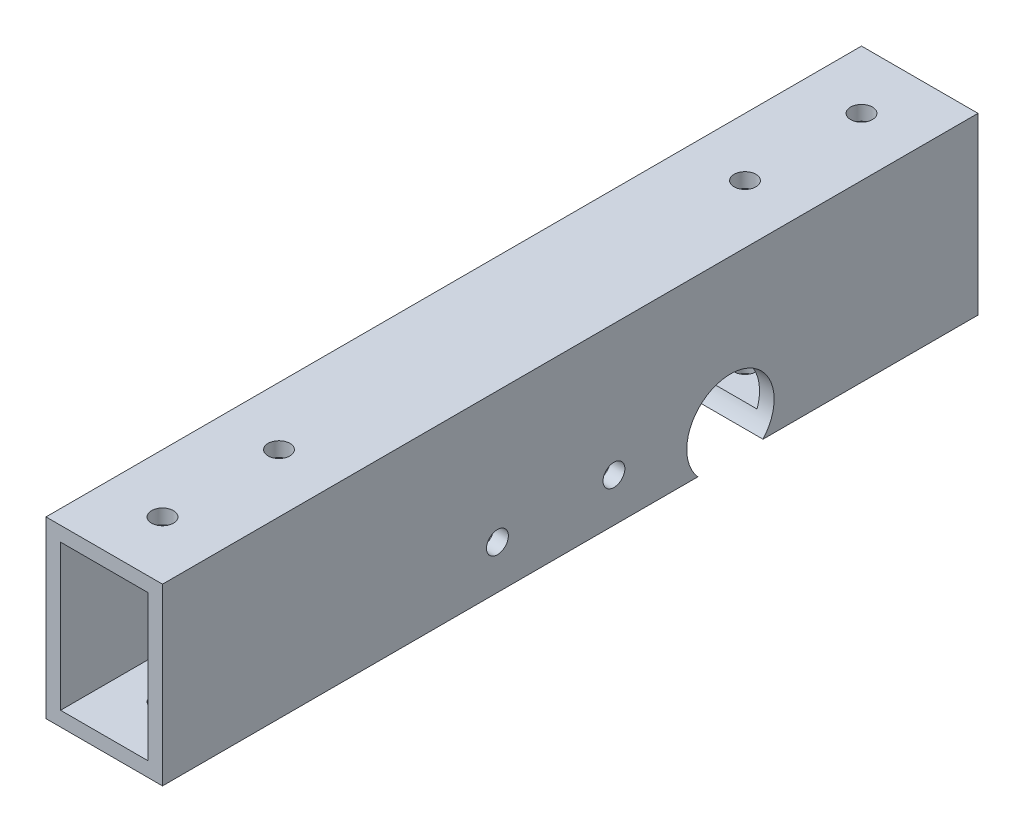
from build123d import *

# Parameters (mm, degrees)
SKETCH1_W           = 25.4
SKETCH1_H           = 38.1
BOSS_EXTRUDE1_DEPTH = 177.8
SHELL1_T            = -3.175
SKETCH2_R           = 9.525
CUT_EXTRUDE1_DEPTH  = 181.612575697
SKETCH3_R           = 2.38125
CUT_EXTRUDE2_DEPTH  = 183.279291199
SKETCH4_R           = 2.38125
CUT_EXTRUDE3_DEPTH  = 181.612575697
SKETCH5_R           = 2.38125
CUT_EXTRUDE4_DEPTH  = 183.279291199


with BuildPart() as part:
    # Sketch1 → Boss-Extrude1 (new body)
    with BuildSketch(Plane.XY):
        Rectangle(SKETCH1_W, SKETCH1_H)
    extrude(amount=BOSS_EXTRUDE1_DEPTH)

    # Shell1
    shell1_openings = [part.faces().sort_by_distance(p)[0] for p in [
        (0, 0, 177.8),
        (0, 0, 0),
    ]]
    offset(amount=SHELL1_T, openings=shell1_openings, kind=Kind.INTERSECTION)

    # Sketch2 → Cut-Extrude1 (cut, through all)
    with BuildSketch(Plane(origin=(12.7, 0, 0), x_dir=(0, 0, -1), z_dir=(1, 0, 0))):
        with Locations((-53.975, -12.7)):
            Circle(SKETCH2_R)
    extrude(amount=-CUT_EXTRUDE1_DEPTH, mode=Mode.SUBTRACT)

    # Sketch3 → Cut-Extrude2 (cut, through all)
    with BuildSketch(Plane(origin=(0, 19.05, 0), x_dir=(1, 0, 0), z_dir=(0, 1, 0))):
        with Locations(Location((0, -165.1, 0), (0, 0, 270))):
            Circle(SKETCH3_R)
        with Locations(Location((0, -139.7, 0), (0, 0, 270))):
            Circle(SKETCH3_R)
    extrude(amount=-CUT_EXTRUDE2_DEPTH, mode=Mode.SUBTRACT)

    # Sketch4 → Cut-Extrude3 (cut, through all)
    with BuildSketch(Plane(origin=(12.7, 0, 0), x_dir=(0, 0, -1), z_dir=(1, 0, 0))):
        with Locations(Location((-79.375, -9.525, 0), (0, 0, 90))):
            Circle(SKETCH4_R)
        with Locations(Location((-104.775, -9.525, 0), (0, 0, 90))):
            Circle(SKETCH4_R)
    extrude(amount=-CUT_EXTRUDE3_DEPTH, mode=Mode.SUBTRACT)

    # Sketch5 → Cut-Extrude4 (cut, through all)
    with BuildSketch(Plane(origin=(0, 19.05, 0), x_dir=(1, 0, 0), z_dir=(0, 1, 0))):
        with Locations(Location((0, -12.7, 0), (0, 0, 270))):
            Circle(SKETCH5_R)
        with Locations(Location((0, -38.1, 0), (0, 0, 270))):
            Circle(SKETCH5_R)
    extrude(amount=-CUT_EXTRUDE4_DEPTH, mode=Mode.SUBTRACT)


solid = part.part
